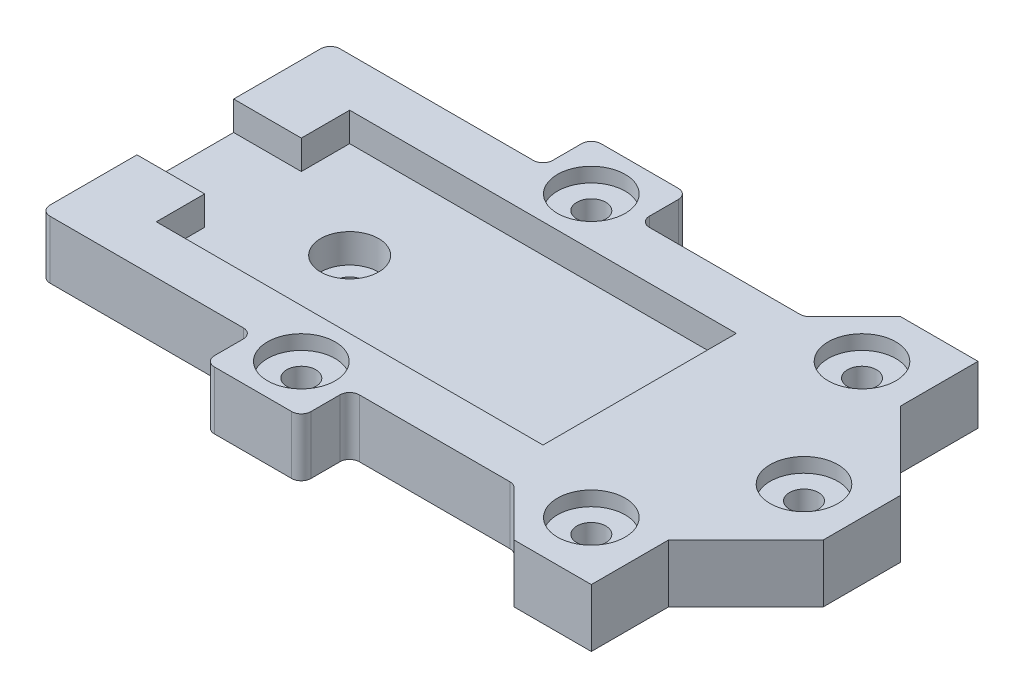
from build123d import *

# Parameters (mm, degrees)
SKETCH_1_R          = 1.5
EXTRUDE_1_DEPTH     = 6
SKETCH_2_W          = 7
SKETCH_2_H          = 5
CUT_EXTRUDE_1_DEPTH = 3
SKETCH_3_R          = 3.5
CUT_EXTRUDE_2_DEPTH = 1.5
SKETCH_5_R          = 3
CUT_EXTRUDE_3_DEPTH = 3
SKETCH_6_R          = 6
EXTRUDE_2_DEPTH     = 3.5
CUT_EXTRUDE_START   = -1
SKETCH_7_R          = 3
CUT_EXTRUDE_4_DEPTH = 1
SKETCH_8_R          = 1.5
CUT_EXTRUDE_5_DEPTH = 49.179352424
FILLET_1_R          = 1


with BuildPart() as part:
    # 草图1 → 凸台-拉伸1 (new body)
    with BuildSketch(Plane(origin=(0, 0, 0), x_dir=(1, 0, 0), z_dir=(0, 1, 0))):
        Polygon((-27, 15), (-27, -15), (-5, -15), (-5, -20), (5, -20), (5, -15), (22, -15), (27, -20), (35, -20), (35, -12), (43, -4), (43, 4), (35, 12), (35, 20), (27, 20), (22, 15), (5, 15), (5, 20), (-5, 20), (-5, 15), align=None)
        with Locations(Location((0, 15, 0), (0, 0, 270))):
            Circle(SKETCH_1_R, mode=Mode.SUBTRACT)
        with Locations(Location((0, -15, 0), (0, 0, 270))):
            Circle(SKETCH_1_R, mode=Mode.SUBTRACT)
        with Locations(Location((29, 14, 0), (0, 0, 270))):
            Circle(SKETCH_1_R, mode=Mode.SUBTRACT)
        with Locations(Location((37, 0, 0), (0, 0, 270))):
            Circle(SKETCH_1_R, mode=Mode.SUBTRACT)
        with Locations(Location((29, -14, 0), (0, 0, 270))):
            Circle(SKETCH_1_R, mode=Mode.SUBTRACT)
    extrude(amount=EXTRUDE_1_DEPTH)

    # 草图2 → 切除-拉伸1 (cut)
    with BuildSketch(Plane(origin=(0, 6, 0), x_dir=(1, 0, 0), z_dir=(0, 1, 0))):
        with Locations((-23.5, 2.5)):
            Rectangle(SKETCH_2_W, SKETCH_2_H)
        with Locations((-23.5, -2.5)):
            Rectangle(SKETCH_2_W, SKETCH_2_H)
        Polygon((20, 10), (-20, 10), (-20, 5), (-20, 0), (20, 0), align=None)
        Polygon((20, 0), (-20, 0), (-20, -5), (-20, -10), (20, -10), align=None)
    extrude(amount=-CUT_EXTRUDE_1_DEPTH, mode=Mode.SUBTRACT)

    # 草图3 → 切除-拉伸2 (cut)
    with BuildSketch(Plane(origin=(0, 6, 0), x_dir=(1, 0, 0), z_dir=(0, 1, 0))):
        with Locations(Location((0, 15, 0), (0, 0, 270))):
            Circle(SKETCH_3_R)
        with Locations(Location((0, -15, 0), (0, 0, 270))):
            Circle(SKETCH_3_R)
        with Locations(Location((29, -14, 0), (0, 0, 270))):
            Circle(SKETCH_3_R)
        with Locations(Location((37, 0, 0), (0, 0, 270))):
            Circle(SKETCH_3_R)
        with Locations(Location((29, 14, 0), (0, 0, 270))):
            Circle(SKETCH_3_R)
    extrude(amount=-CUT_EXTRUDE_2_DEPTH, mode=Mode.SUBTRACT)

    # 草图5 → 切除-拉伸3 (cut)
    with BuildSketch(Plane(origin=(0, 3, 0), x_dir=(1, 0, 0), z_dir=(0, 1, 0))):
        with Locations(Location((-10, 0, 0), (0, 0, 270))):
            Circle(SKETCH_5_R)
    extrude(amount=-CUT_EXTRUDE_3_DEPTH, mode=Mode.SUBTRACT)

    # 草图6 → 凸台-拉伸2 (add)
    with BuildSketch(Plane.XZ):
        with Locations(Location((-10, 0, 0), (0, 0, 90))):
            Circle(SKETCH_6_R)
    extrude(amount=EXTRUDE_2_DEPTH)

    # 草图7 → 切除-拉伸4 (cut)
    with BuildSketch(Plane.XZ.offset(3.5).offset(CUT_EXTRUDE_START)):
        with Locations(Location((-10, 0, 0), (0, 0, 90))):
            Circle(SKETCH_7_R)
    extrude(amount=CUT_EXTRUDE_4_DEPTH, mode=Mode.SUBTRACT)

    # 草图8 → 切除-拉伸5 (cut, through all)
    with BuildSketch(Plane.XZ.offset(2.5)):
        with Locations(Location((-10, 0, 0), (0, 0, 270))):
            Circle(SKETCH_8_R)
    extrude(amount=-CUT_EXTRUDE_5_DEPTH, mode=Mode.SUBTRACT)

    # 圆角1
    fillet_1_edges = [part.edges().sort_by_distance(p)[0] for p in [
        (22, 3, -15),
        (22, 3, 15),
        (5, 3, 15),
        (5, 3, 20),
        (-5, 3, 20),
        (-5, 3, 15),
        (-27, 3, 15),
        (-27, 3, -15),
        (-5, 3, -15),
        (-5, 3, -20),
        (5, 3, -20),
        (5, 3, -15),
    ]]
    fillet(fillet_1_edges, radius=FILLET_1_R)


solid = part.part
